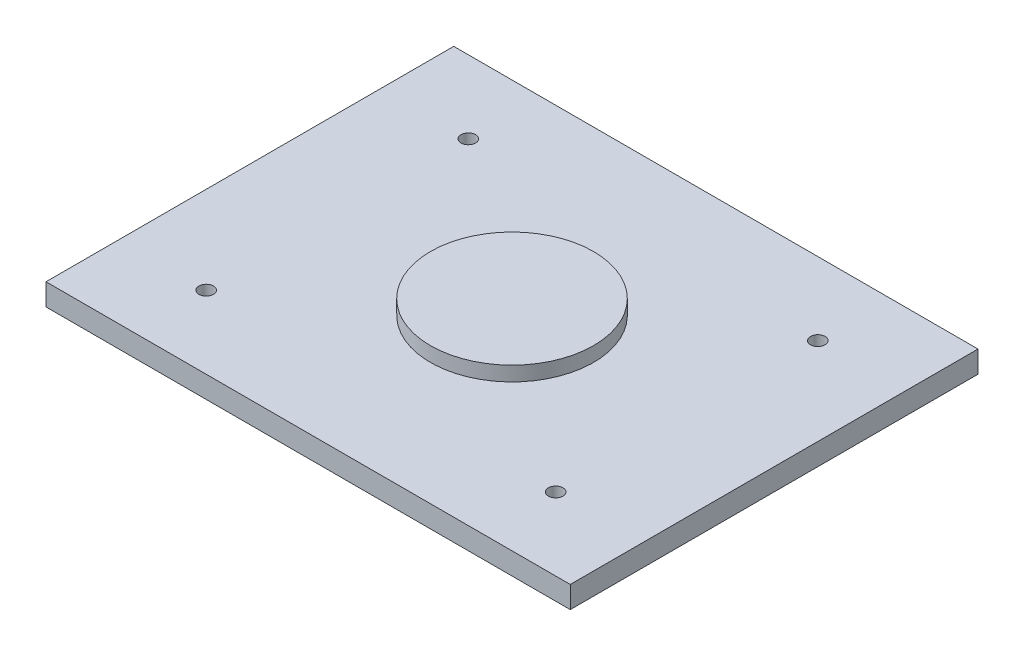
from build123d import *

# Parameters (mm, degrees)
SKETCH1_W               = 228.6
SKETCH1_H               = 177.8
BOSS_EXTRUDE1_DEPTH     = 9.525
F_1_4_20_TAPPED_HOLE1_D = 6.35
SKETCH5_R               = 35.56
BOSS_EXTRUDE2_DEPTH     = 6.35


with BuildPart() as part:
    # Sketch1 → Boss-Extrude1 (new body)
    with BuildSketch(Plane(origin=(0, 0, 0), x_dir=(1, 0, 0), z_dir=(0, 1, 0))):
        Rectangle(SKETCH1_W, SKETCH1_H)
    extrude(amount=BOSS_EXTRUDE1_DEPTH)

    # 1/4-20 Tapped Hole1 (through all)
    with Locations(Plane(origin=(0, 9.525, 0), x_dir=(-1, 0, 0), z_dir=(0, 1, 0))):
        with Locations((76.2, -57.15), (76.2, 57.15), (-76.2, 57.15), (-76.2, -57.15)):
            Hole(F_1_4_20_TAPPED_HOLE1_D / 2)

    # Sketch5 → Boss-Extrude2 (add)
    with BuildSketch(Plane(origin=(0, 9.525, 0), x_dir=(1, 0, 0), z_dir=(0, 1, 0))):
        with Locations(Location((0, 0, 0), (0, 0, 90))):
            Circle(SKETCH5_R)
    extrude(amount=BOSS_EXTRUDE2_DEPTH)


solid = part.part
